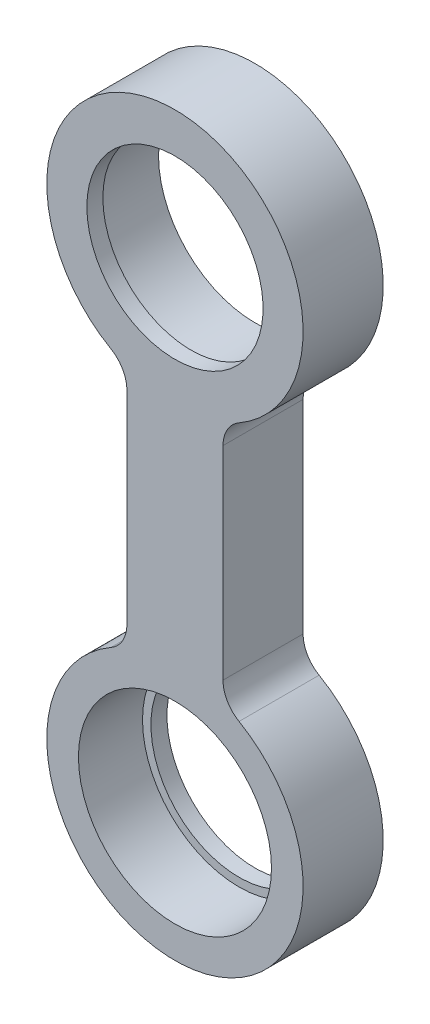
from build123d import *

# Parameters (mm, degrees)
EXTRUDE_1_DEPTH               = 5
HOLE_WIZARD_M10_1_D           = 11
HOLE_WIZARD_M10_1_CBORE_D     = 12.05
HOLE_WIZARD_M10_1_CBORE_DEPTH = 4
HOLE_WIZARD_M10_2_D           = 11
HOLE_WIZARD_M10_2_CBORE_D     = 12.05
HOLE_WIZARD_M10_2_CBORE_DEPTH = 4
FILLET_1_R                    = 2


with BuildPart() as part:
    # 草图1 → 凸台-拉伸1 (new body)
    with BuildSketch(Plane(origin=(0, 0, 0), x_dir=(-1, 0, 0), z_dir=(0, 0, -1))):
        with BuildLine():
            Line((-3, 22.583801513), (-3, 7.416198487))
            ThreePointArc((-3, 7.416198487), (0, -8), (3, 7.416198487))
            Line((3, 7.416198487), (3, 22.583801513))
            ThreePointArc((3, 22.583801513), (0, 38), (-3, 22.583801513))
        make_face()
    extrude(amount=-EXTRUDE_1_DEPTH)

    # M10 六角头螺栓的柱形沉头孔1 (through all)
    with Locations(Plane(origin=(0, 0, 0), x_dir=(-1, 0, 0), z_dir=(0, 0, -1))):
        with Locations((0, 30)):
            CounterBoreHole(HOLE_WIZARD_M10_1_D / 2, HOLE_WIZARD_M10_1_CBORE_D / 2, HOLE_WIZARD_M10_1_CBORE_DEPTH)

    # M10 六角头螺栓的柱形沉头孔2 (through all)
    with Locations(Plane.XY.offset(5)):
        with Locations((0, 0)):
            CounterBoreHole(HOLE_WIZARD_M10_2_D / 2, HOLE_WIZARD_M10_2_CBORE_D / 2, HOLE_WIZARD_M10_2_CBORE_DEPTH)

    # 圆角1
    fillet_1_edges = [part.edges().sort_by_distance(p)[0] for p in [
        (-3, 22.583801513, 2.5),
        (-3, 7.416198487, 2.5),
        (3, 7.416198487, 2.5),
        (3, 22.583801513, 2.5),
    ]]
    fillet(fillet_1_edges, radius=FILLET_1_R)


solid = part.part
